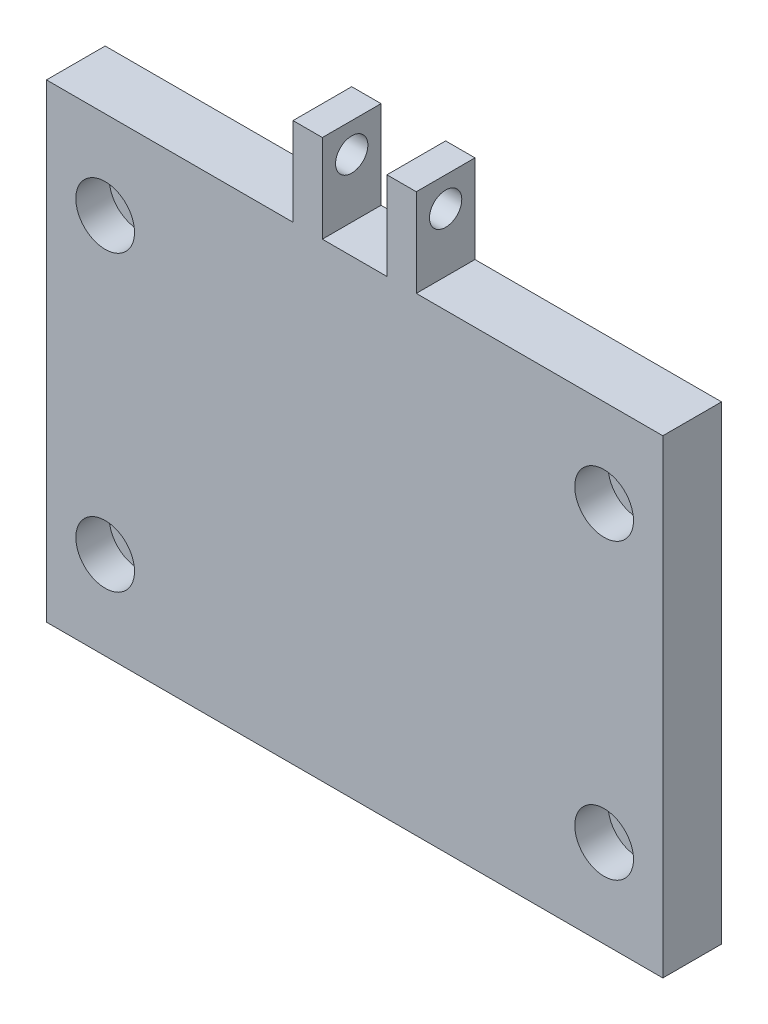
from build123d import *

# Parameters (mm, degrees)
SKETCH_1_W                = 105
SKETCH_1_H                = 80
SKETCH_1_R                = 2.5
SKETCH_1_W_2              = 5
SKETCH_1_H_2              = 15
EXTRUDE_1_DEPTH           = 5
HOLE_WIZARD_1_D           = 5.5
HOLE_WIZARD_1_CBORE_D     = 10
HOLE_WIZARD_1_CBORE_DEPTH = 5.7
SKETCH_4_R                = 2.75
CUT_EXTRUDE_1_DEPTH       = 84.779472426


with BuildPart() as part:
    # 草图1 → 凸台-拉伸1 (new, symmetric)
    # profile 1 of 3: a face of its own
    with BuildSketch(Plane.XY):
        Rectangle(SKETCH_1_W, SKETCH_1_H)
        with Locations((42.5, 25)):
            Circle(SKETCH_1_R, mode=Mode.SUBTRACT)
        with Locations((-42.5, 25)):
            Circle(SKETCH_1_R, mode=Mode.SUBTRACT)
        with Locations((42.5, -25)):
            Circle(SKETCH_1_R, mode=Mode.SUBTRACT)
        with Locations((-42.5, -25)):
            Circle(SKETCH_1_R, mode=Mode.SUBTRACT)
    # profile 2 of 3: a face of its own
    with BuildSketch(Plane.XY):
        with Locations((-8, 47.5)):
            Rectangle(SKETCH_1_W_2, SKETCH_1_H_2)
    # profile 3 of 3: a face of its own
    with BuildSketch(Plane.XY):
        with Locations((8, 47.5)):
            Rectangle(SKETCH_1_W_2, SKETCH_1_H_2)
    extrude(amount=EXTRUDE_1_DEPTH, both=True)

    # 打孔尺寸(%根据)内六角圆柱头螺钉的类型1 (through all)
    with Locations(Plane.XY.offset(5)):
        with Locations((-42.5, 25), (42.5, 25), (42.5, -25), (-42.5, -25)):
            CounterBoreHole(HOLE_WIZARD_1_D / 2, HOLE_WIZARD_1_CBORE_D / 2, HOLE_WIZARD_1_CBORE_DEPTH)

    # 草图4 → 切除-拉伸1 (cut, through all)
    with BuildSketch(Plane.ZY.offset(10.5)):
        with Locations(Location((0, 50, 0), (0, 0, 270))):
            Circle(SKETCH_4_R)
    extrude(amount=-CUT_EXTRUDE_1_DEPTH, mode=Mode.SUBTRACT)


solid = part.part
